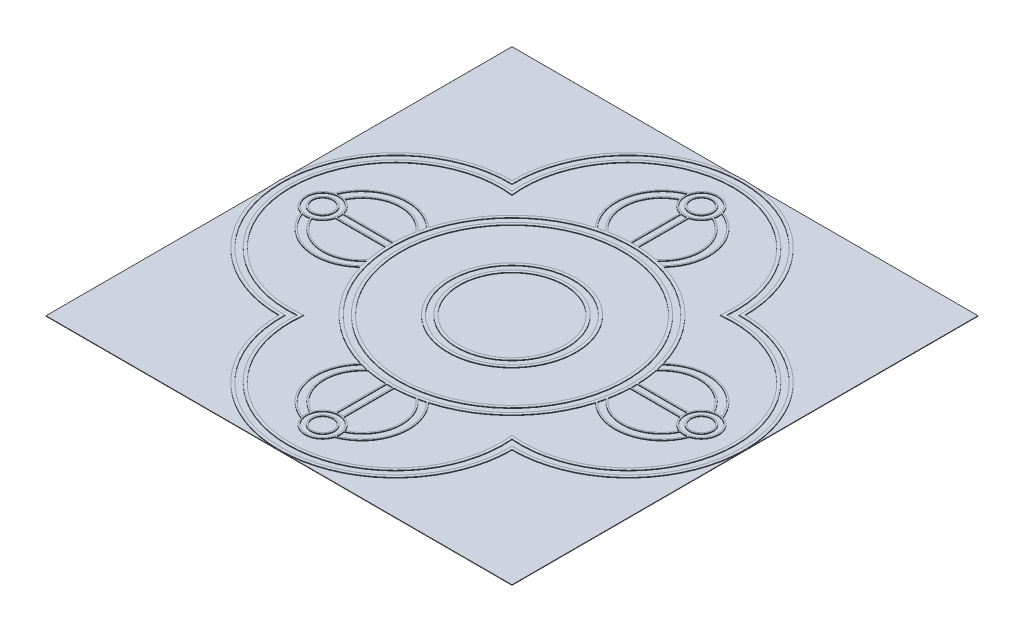
from build123d import *

# Parameters (mm, degrees)
SKETCH1_W           = 203.2
SKETCH1_H           = 203.2
BOSS_EXTRUDE1_DEPTH = 0.2032
SKETCH2_R           = 7.62
SKETCH2_R_2         = 6.985
SKETCH2_R_3         = 5.08
SKETCH2_R_4         = 4.445
SKETCH2_R_5         = 53.34
SKETCH2_R_6         = 52.07
SKETCH2_R_7         = 49.53
SKETCH2_R_8         = 48.26
SKETCH2_R_9         = 27.94
SKETCH2_R_10        = 26.67
SKETCH2_R_11        = 24.13
SKETCH2_R_12        = 22.86
BOSS_EXTRUDE2_DEPTH = 0.254
SCALE1_SCALE        = 0.875


with BuildPart() as part:
    # Sketch1 → Boss-Extrude1 (new body)
    with BuildSketch(Plane(origin=(0, 0, 0), x_dir=(1, 0, 0), z_dir=(0, 1, 0))):
        Rectangle(SKETCH1_W, SKETCH1_H)
    extrude(amount=BOSS_EXTRUDE1_DEPTH)

    # Sketch2 → Boss-Extrude2 (add)
    # profile 1 of 38: a face of its own
    with BuildSketch(Plane(origin=(0, 0.2032, 0), x_dir=(1, 0, 0), z_dir=(0, 1, 0))):
        with BuildLine():
            ThreePointArc((50.8, 50.8), (0, 101.6), (-50.8, 50.8))
            ThreePointArc((-50.8, 50.8), (-101.6, 0), (-50.8, -50.8))
            ThreePointArc((-50.8, -50.8), (0, -101.6), (50.8, -50.8))
            ThreePointArc((50.8, -50.8), (101.6, 0), (50.8, 50.8))
        make_face()
        with BuildLine():
            ThreePointArc((49.513283683, 49.513283683), (0, 100.33), (-49.513283683, 49.513283683))
            ThreePointArc((-49.513283683, 49.513283683), (-100.33, 0), (-49.513283683, -49.513283683))
            ThreePointArc((-49.513283683, -49.513283683), (0, -100.33), (49.513283683, -49.513283683))
            ThreePointArc((49.513283683, -49.513283683), (100.33, 0), (49.513283683, 49.513283683))
        make_face(mode=Mode.SUBTRACT)
    # profile 2 of 38: a face of its own
    with BuildSketch(Plane(origin=(0, 0.2032, 0), x_dir=(1, 0, 0), z_dir=(0, 1, 0))):
        with BuildLine():
            ThreePointArc((-46.821252298, -46.821252298), (0, -97.79), (46.821252298, -46.821252298))
            ThreePointArc((46.821252298, -46.821252298), (97.79, 0), (46.821252298, 46.821252298))
            ThreePointArc((46.821252298, 46.821252298), (0, 97.79), (-46.821252298, 46.821252298))
            ThreePointArc((-46.821252298, 46.821252298), (-97.79, 0), (-46.821252298, -46.821252298))
        make_face()
        with BuildLine():
            ThreePointArc((45.39998, -45.39998), (96.52, 0), (45.39998, 45.39998))
            ThreePointArc((45.39998, 45.39998), (0, 96.52), (-45.39998, 45.39998))
            ThreePointArc((-45.39998, 45.39998), (-96.52, 0), (-45.39998, -45.39998))
            ThreePointArc((-45.39998, -45.39998), (0, -96.52), (45.39998, -45.39998))
        make_face(mode=Mode.SUBTRACT)
    # profile 3 of 38: a face of its own
    with BuildSketch(Plane(origin=(0, 0.2032, 0), x_dir=(1, 0, 0), z_dir=(0, 1, 0))):
        with BuildLine():
            ThreePointArc((-14.140206565, -51.431606608), (-14.488561631, -51.334561281), (-14.836250773, -51.235156514))
            ThreePointArc((-14.836250773, -51.235156514), (-20.079114581, -70.016649628), (-7.29761335, -84.74299781))
            ThreePointArc((-7.29761335, -84.74299781), (-7.399941516, -84.368038932), (-7.483017374, -83.988350091))
            ThreePointArc((-7.483017374, -83.988350091), (-19.54165653, -69.495094183), (-14.140206565, -51.431606608))
        make_face()
    # profile 4 of 38: a face of its own
    with BuildSketch(Plane(origin=(0, 0.2032, 0), x_dir=(1, 0, 0), z_dir=(0, 1, 0))):
        with BuildLine():
            ThreePointArc((-10.393246617, -52.317645444), (-10.791344461, -52.236983878), (-11.188816524, -52.153293135))
            ThreePointArc((-11.188816524, -52.153293135), (-17.04635084, -67.470533704), (-7.400053136, -80.732415454))
            ThreePointArc((-7.400053136, -80.732415454), (-7.316674828, -80.421463072), (-7.220236461, -80.114310068))
            ThreePointArc((-7.220236461, -80.114310068), (-16.453642077, -67.088877199), (-10.393246617, -52.317645444))
        make_face()
    # profile 5 of 38: a face of its own
    with BuildSketch(Plane(origin=(0, 0.2032, 0), x_dir=(1, 0, 0), z_dir=(0, 1, 0))):
        with BuildLine():
            ThreePointArc((7.29761335, -84.74299781), (20.079114581, -70.016649628), (14.836250773, -51.235156514))
            ThreePointArc((14.836250773, -51.235156514), (14.488561631, -51.334561281), (14.140206565, -51.431606608))
            ThreePointArc((14.140206565, -51.431606608), (19.54165653, -69.495094183), (7.483017374, -83.988350091))
            ThreePointArc((7.483017374, -83.988350091), (7.399941516, -84.368038932), (7.29761335, -84.74299781))
        make_face()
    # profile 6 of 38: a face of its own
    with BuildSketch(Plane(origin=(0, 0.2032, 0), x_dir=(1, 0, 0), z_dir=(0, 1, 0))):
        with BuildLine():
            ThreePointArc((7.400053136, -80.732415454), (17.04635084, -67.470533704), (11.188816524, -52.153293135))
            ThreePointArc((11.188816524, -52.153293135), (10.791344461, -52.236983878), (10.393246617, -52.317645444))
            ThreePointArc((10.393246617, -52.317645444), (16.453642077, -67.088877199), (7.220236461, -80.114310068))
            ThreePointArc((7.220236461, -80.114310068), (7.316674828, -80.421463072), (7.400053136, -80.732415454))
        make_face()
    # profile 7 of 38: a face of its own
    with BuildSketch(Plane(origin=(0, 0.2032, 0), x_dir=(1, 0, 0), z_dir=(0, 1, 0))):
        with BuildLine():
            ThreePointArc((-1.27, -53.324878809), (-1.587528149, -53.316370416), (-1.905, -53.305971288))
            Line((-1.905, -53.305971288), (-1.905, -75.171966725))
            ThreePointArc((-1.905, -75.171966725), (-1.588942646, -75.097506372), (-1.27, -75.036578675))
            Line((-1.27, -75.036578675), (-1.27, -53.324878809))
        make_face()
    # profile 8 of 38: a face of its own
    with BuildSketch(Plane(origin=(0, 0.2032, 0), x_dir=(1, 0, 0), z_dir=(0, 1, 0))):
        with Locations((0, -82.55)):
            Circle(SKETCH2_R)
        with Locations(Location((0, -82.55, 0), (0, 0, 270))):
            Circle(SKETCH2_R_2, mode=Mode.SUBTRACT)
    # profile 9 of 38: a face of its own
    with BuildSketch(Plane(origin=(0, 0.2032, 0), x_dir=(1, 0, 0), z_dir=(0, 1, 0))):
        with Locations(Location((0, -82.55, 0), (0, 0, 90))):
            Circle(SKETCH2_R_3)
        with Locations(Location((0, -82.55, 0), (0, 0, 270))):
            Circle(SKETCH2_R_4, mode=Mode.SUBTRACT)
    # profile 10 of 38: a face of its own
    with BuildSketch(Plane(origin=(0, 0.2032, 0), x_dir=(1, 0, 0), z_dir=(0, 1, 0))):
        with BuildLine():
            Line((1.905, -75.171966725), (1.905, -53.305971288))
            ThreePointArc((1.905, -53.305971288), (1.587528149, -53.316370416), (1.27, -53.324878809))
            Line((1.27, -53.324878809), (1.27, -75.036578675))
            ThreePointArc((1.27, -75.036578675), (1.588942646, -75.097506372), (1.905, -75.171966725))
        make_face()
    # profile 11 of 38: a face of its own
    with BuildSketch(Plane(origin=(0, 0.2032, 0), x_dir=(1, 0, 0), z_dir=(0, 1, 0))):
        with BuildLine():
            ThreePointArc((51.235156514, -14.836250773), (70.016649628, -20.079114581), (84.74299781, -7.29761335))
            ThreePointArc((84.74299781, -7.29761335), (84.368038932, -7.399941516), (83.988350091, -7.483017374))
            ThreePointArc((83.988350091, -7.483017374), (69.495094183, -19.54165653), (51.431606608, -14.140206565))
            ThreePointArc((51.431606608, -14.140206565), (51.334561281, -14.488561631), (51.235156514, -14.836250773))
        make_face()
    # profile 12 of 38: a face of its own
    with BuildSketch(Plane(origin=(0, 0.2032, 0), x_dir=(1, 0, 0), z_dir=(0, 1, 0))):
        with BuildLine():
            ThreePointArc((52.153293135, -11.188816524), (67.470533704, -17.04635084), (80.732415454, -7.400053136))
            ThreePointArc((80.732415454, -7.400053136), (80.421463072, -7.316674828), (80.114310068, -7.220236461))
            ThreePointArc((80.114310068, -7.220236461), (67.088877199, -16.453642077), (52.317645444, -10.393246617))
            ThreePointArc((52.317645444, -10.393246617), (52.236983878, -10.791344461), (52.153293135, -11.188816524))
        make_face()
    # profile 13 of 38: a face of its own
    with BuildSketch(Plane(origin=(0, 0.2032, 0), x_dir=(1, 0, 0), z_dir=(0, 1, 0))):
        with BuildLine():
            ThreePointArc((75.171966725, -1.905), (75.097506372, -1.588942646), (75.036578675, -1.27))
            Line((75.036578675, -1.27), (53.324878809, -1.27))
            ThreePointArc((53.324878809, -1.27), (53.316370416, -1.587528149), (53.305971288, -1.905))
            Line((53.305971288, -1.905), (75.171966725, -1.905))
        make_face()
    # profile 14 of 38: a face of its own
    with BuildSketch(Plane(origin=(0, 0.2032, 0), x_dir=(1, 0, 0), z_dir=(0, 1, 0))):
        with BuildLine():
            Line((75.171966725, 1.905), (53.305971288, 1.905))
            ThreePointArc((53.305971288, 1.905), (53.316370416, 1.587528149), (53.324878809, 1.27))
            Line((53.324878809, 1.27), (75.036578675, 1.27))
            ThreePointArc((75.036578675, 1.27), (75.097506372, 1.588942646), (75.171966725, 1.905))
        make_face()
    # profile 15 of 38: a face of its own
    with BuildSketch(Plane(origin=(0, 0.2032, 0), x_dir=(1, 0, 0), z_dir=(0, 1, 0))):
        with Locations((82.55, 0)):
            Circle(SKETCH2_R)
        with Locations(Location((82.55, 0, 0), (0, 0, 270))):
            Circle(SKETCH2_R_2, mode=Mode.SUBTRACT)
    # profile 16 of 38: a face of its own
    with BuildSketch(Plane(origin=(0, 0.2032, 0), x_dir=(1, 0, 0), z_dir=(0, 1, 0))):
        with Locations(Location((82.55, 0, 0), (0, 0, 90))):
            Circle(SKETCH2_R_3)
        with Locations(Location((82.55, 0, 0), (0, 0, 270))):
            Circle(SKETCH2_R_4, mode=Mode.SUBTRACT)
    # profile 17 of 38: a face of its own
    with BuildSketch(Plane(origin=(0, 0.2032, 0), x_dir=(1, 0, 0), z_dir=(0, 1, 0))):
        with BuildLine():
            ThreePointArc((80.732415454, 7.400053136), (67.470533704, 17.04635084), (52.153293135, 11.188816524))
            ThreePointArc((52.153293135, 11.188816524), (52.236983878, 10.791344461), (52.317645444, 10.393246617))
            ThreePointArc((52.317645444, 10.393246617), (67.088877199, 16.453642077), (80.114310068, 7.220236461))
            ThreePointArc((80.114310068, 7.220236461), (80.421463072, 7.316674828), (80.732415454, 7.400053136))
        make_face()
    # profile 18 of 38: a face of its own
    with BuildSketch(Plane(origin=(0, 0.2032, 0), x_dir=(1, 0, 0), z_dir=(0, 1, 0))):
        with BuildLine():
            ThreePointArc((84.74299781, 7.29761335), (70.016649628, 20.079114581), (51.235156514, 14.836250773))
            ThreePointArc((51.235156514, 14.836250773), (51.334561281, 14.488561631), (51.431606608, 14.140206565))
            ThreePointArc((51.431606608, 14.140206565), (69.495094183, 19.54165653), (83.988350091, 7.483017374))
            ThreePointArc((83.988350091, 7.483017374), (84.368038932, 7.399941516), (84.74299781, 7.29761335))
        make_face()
    # profile 19 of 38: a face of its own
    with BuildSketch(Plane(origin=(0, 0.2032, 0), x_dir=(1, 0, 0), z_dir=(0, 1, 0))):
        Circle(SKETCH2_R_5)
        with Locations(Location((0, 0, 0), (0, 0, 270))):
            Circle(SKETCH2_R_6, mode=Mode.SUBTRACT)
    # profile 20 of 38: a face of its own
    with BuildSketch(Plane(origin=(0, 0.2032, 0), x_dir=(1, 0, 0), z_dir=(0, 1, 0))):
        with Locations(Location((0, 0, 0), (0, 0, 90))):
            Circle(SKETCH2_R_7)
        with Locations(Location((0, 0, 0), (0, 0, 270))):
            Circle(SKETCH2_R_8, mode=Mode.SUBTRACT)
    # profile 21 of 38: a face of its own
    with BuildSketch(Plane(origin=(0, 0.2032, 0), x_dir=(1, 0, 0), z_dir=(0, 1, 0))):
        with BuildLine():
            ThreePointArc((7.483017374, 83.988350091), (19.54165653, 69.495094183), (14.140206565, 51.431606608))
            ThreePointArc((14.140206565, 51.431606608), (14.488561631, 51.334561281), (14.836250773, 51.235156514))
            ThreePointArc((14.836250773, 51.235156514), (20.079114581, 70.016649628), (7.29761335, 84.74299781))
            ThreePointArc((7.29761335, 84.74299781), (7.399941516, 84.368038932), (7.483017374, 83.988350091))
        make_face()
    # profile 22 of 38: a face of its own
    with BuildSketch(Plane(origin=(0, 0.2032, 0), x_dir=(1, 0, 0), z_dir=(0, 1, 0))):
        with BuildLine():
            ThreePointArc((7.400053136, 80.732415454), (7.316674828, 80.421463072), (7.220236461, 80.114310068))
            ThreePointArc((7.220236461, 80.114310068), (16.453642077, 67.088877199), (10.393246617, 52.317645444))
            ThreePointArc((10.393246617, 52.317645444), (10.791344461, 52.236983878), (11.188816524, 52.153293135))
            ThreePointArc((11.188816524, 52.153293135), (17.04635084, 67.470533704), (7.400053136, 80.732415454))
        make_face()
    # profile 23 of 38: a face of its own
    with BuildSketch(Plane(origin=(0, 0.2032, 0), x_dir=(1, 0, 0), z_dir=(0, 1, 0))):
        with BuildLine():
            ThreePointArc((1.905, 75.171966725), (1.588942646, 75.097506372), (1.27, 75.036578675))
            Line((1.27, 75.036578675), (1.27, 53.324878809))
            ThreePointArc((1.27, 53.324878809), (1.587528149, 53.316370416), (1.905, 53.305971288))
            Line((1.905, 53.305971288), (1.905, 75.171966725))
        make_face()
    # profile 24 of 38: a face of its own
    with BuildSketch(Plane(origin=(0, 0.2032, 0), x_dir=(1, 0, 0), z_dir=(0, 1, 0))):
        with BuildLine():
            Line((-1.27, 53.324878809), (-1.27, 75.036578675))
            ThreePointArc((-1.27, 75.036578675), (-1.588942646, 75.097506372), (-1.905, 75.171966725))
            Line((-1.905, 75.171966725), (-1.905, 53.305971288))
            ThreePointArc((-1.905, 53.305971288), (-1.587528149, 53.316370416), (-1.27, 53.324878809))
        make_face()
    # profile 25 of 38: a face of its own
    with BuildSketch(Plane(origin=(0, 0.2032, 0), x_dir=(1, 0, 0), z_dir=(0, 1, 0))):
        with BuildLine():
            ThreePointArc((-14.140206565, 51.431606608), (-19.54165653, 69.495094183), (-7.483017374, 83.988350091))
            ThreePointArc((-7.483017374, 83.988350091), (-7.399941516, 84.368038932), (-7.29761335, 84.74299781))
            ThreePointArc((-7.29761335, 84.74299781), (-20.079114581, 70.016649628), (-14.836250773, 51.235156514))
            ThreePointArc((-14.836250773, 51.235156514), (-14.488561631, 51.334561281), (-14.140206565, 51.431606608))
        make_face()
    # profile 26 of 38: a face of its own
    with BuildSketch(Plane(origin=(0, 0.2032, 0), x_dir=(1, 0, 0), z_dir=(0, 1, 0))):
        with BuildLine():
            ThreePointArc((-10.393246617, 52.317645444), (-16.453642077, 67.088877199), (-7.220236461, 80.114310068))
            ThreePointArc((-7.220236461, 80.114310068), (-7.316674828, 80.421463072), (-7.400053136, 80.732415454))
            ThreePointArc((-7.400053136, 80.732415454), (-17.04635084, 67.470533704), (-11.188816524, 52.153293135))
            ThreePointArc((-11.188816524, 52.153293135), (-10.791344461, 52.236983878), (-10.393246617, 52.317645444))
        make_face()
    # profile 27 of 38: a face of its own
    with BuildSketch(Plane(origin=(0, 0.2032, 0), x_dir=(1, 0, 0), z_dir=(0, 1, 0))):
        with Locations((0, 82.55)):
            Circle(SKETCH2_R)
        with Locations(Location((0, 82.55, 0), (0, 0, 270))):
            Circle(SKETCH2_R_2, mode=Mode.SUBTRACT)
    # profile 28 of 38: a face of its own
    with BuildSketch(Plane(origin=(0, 0.2032, 0), x_dir=(1, 0, 0), z_dir=(0, 1, 0))):
        with Locations(Location((0, 82.55, 0), (0, 0, 90))):
            Circle(SKETCH2_R_3)
        with Locations(Location((0, 82.55, 0), (0, 0, 270))):
            Circle(SKETCH2_R_4, mode=Mode.SUBTRACT)
    # profile 29 of 38: a face of its own
    with BuildSketch(Plane(origin=(0, 0.2032, 0), x_dir=(1, 0, 0), z_dir=(0, 1, 0))):
        with Locations(Location((0, 0, 0), (0, 0, 90))):
            Circle(SKETCH2_R_9)
        with Locations(Location((0, 0, 0), (0, 0, 270))):
            Circle(SKETCH2_R_10, mode=Mode.SUBTRACT)
    # profile 30 of 38: a face of its own
    with BuildSketch(Plane(origin=(0, 0.2032, 0), x_dir=(1, 0, 0), z_dir=(0, 1, 0))):
        with Locations(Location((0, 0, 0), (0, 0, 90))):
            Circle(SKETCH2_R_11)
        with Locations(Location((0, 0, 0), (0, 0, 270))):
            Circle(SKETCH2_R_12, mode=Mode.SUBTRACT)
    # profile 31 of 38: a face of its own
    with BuildSketch(Plane(origin=(0, 0.2032, 0), x_dir=(1, 0, 0), z_dir=(0, 1, 0))):
        with BuildLine():
            ThreePointArc((-83.988350091, -7.483017374), (-84.368038932, -7.399941516), (-84.74299781, -7.29761335))
            ThreePointArc((-84.74299781, -7.29761335), (-70.016649628, -20.079114581), (-51.235156514, -14.836250773))
            ThreePointArc((-51.235156514, -14.836250773), (-51.334561281, -14.488561631), (-51.431606608, -14.140206565))
            ThreePointArc((-51.431606608, -14.140206565), (-69.495094183, -19.54165653), (-83.988350091, -7.483017374))
        make_face()
    # profile 32 of 38: a face of its own
    with BuildSketch(Plane(origin=(0, 0.2032, 0), x_dir=(1, 0, 0), z_dir=(0, 1, 0))):
        with BuildLine():
            ThreePointArc((-80.114310068, -7.220236461), (-80.421463072, -7.316674828), (-80.732415454, -7.400053136))
            ThreePointArc((-80.732415454, -7.400053136), (-67.470533704, -17.04635084), (-52.153293135, -11.188816524))
            ThreePointArc((-52.153293135, -11.188816524), (-52.236983878, -10.791344461), (-52.317645444, -10.393246617))
            ThreePointArc((-52.317645444, -10.393246617), (-67.088877199, -16.453642077), (-80.114310068, -7.220236461))
        make_face()
    # profile 33 of 38: a face of its own
    with BuildSketch(Plane(origin=(0, 0.2032, 0), x_dir=(1, 0, 0), z_dir=(0, 1, 0))):
        with Locations((-82.55, 0)):
            Circle(SKETCH2_R)
        with Locations(Location((-82.55, 0, 0), (0, 0, 270))):
            Circle(SKETCH2_R_2, mode=Mode.SUBTRACT)
    # profile 34 of 38: a face of its own
    with BuildSketch(Plane(origin=(0, 0.2032, 0), x_dir=(1, 0, 0), z_dir=(0, 1, 0))):
        with Locations(Location((-82.55, 0, 0), (0, 0, 90))):
            Circle(SKETCH2_R_3)
        with Locations(Location((-82.55, 0, 0), (0, 0, 270))):
            Circle(SKETCH2_R_4, mode=Mode.SUBTRACT)
    # profile 35 of 38: a face of its own
    with BuildSketch(Plane(origin=(0, 0.2032, 0), x_dir=(1, 0, 0), z_dir=(0, 1, 0))):
        with BuildLine():
            ThreePointArc((-53.324878809, 1.27), (-53.316370416, 1.587528149), (-53.305971288, 1.905))
            Line((-53.305971288, 1.905), (-75.171966725, 1.905))
            ThreePointArc((-75.171966725, 1.905), (-75.097506372, 1.588942646), (-75.036578675, 1.27))
            Line((-75.036578675, 1.27), (-53.324878809, 1.27))
        make_face()
    # profile 36 of 38: a face of its own
    with BuildSketch(Plane(origin=(0, 0.2032, 0), x_dir=(1, 0, 0), z_dir=(0, 1, 0))):
        with BuildLine():
            ThreePointArc((-53.305971288, -1.905), (-53.316370416, -1.587528149), (-53.324878809, -1.27))
            Line((-53.324878809, -1.27), (-75.036578675, -1.27))
            ThreePointArc((-75.036578675, -1.27), (-75.097506372, -1.588942646), (-75.171966725, -1.905))
            Line((-75.171966725, -1.905), (-53.305971288, -1.905))
        make_face()
    # profile 37 of 38: a face of its own
    with BuildSketch(Plane(origin=(0, 0.2032, 0), x_dir=(1, 0, 0), z_dir=(0, 1, 0))):
        with BuildLine():
            ThreePointArc((-51.431606608, 14.140206565), (-51.334561281, 14.488561631), (-51.235156514, 14.836250773))
            ThreePointArc((-51.235156514, 14.836250773), (-70.016649628, 20.079114581), (-84.74299781, 7.29761335))
            ThreePointArc((-84.74299781, 7.29761335), (-84.368038932, 7.399941516), (-83.988350091, 7.483017374))
            ThreePointArc((-83.988350091, 7.483017374), (-69.495094183, 19.54165653), (-51.431606608, 14.140206565))
        make_face()
    # profile 38 of 38: a face of its own
    with BuildSketch(Plane(origin=(0, 0.2032, 0), x_dir=(1, 0, 0), z_dir=(0, 1, 0))):
        with BuildLine():
            ThreePointArc((-52.317645444, 10.393246617), (-52.236983878, 10.791344461), (-52.153293135, 11.188816524))
            ThreePointArc((-52.153293135, 11.188816524), (-67.470533704, 17.04635084), (-80.732415454, 7.400053136))
            ThreePointArc((-80.732415454, 7.400053136), (-80.421463072, 7.316674828), (-80.114310068, 7.220236461))
            ThreePointArc((-80.114310068, 7.220236461), (-67.088877199, 16.453642077), (-52.317645444, 10.393246617))
        make_face()
    extrude(amount=BOSS_EXTRUDE2_DEPTH)


with BuildPart() as part_1:
    # Scale1: scaled about (0, 0.123434609, 0)
    add(part.part.scale(SCALE1_SCALE).moved(Location((0, 0.015429326, 0))))


solid = part_1.part
